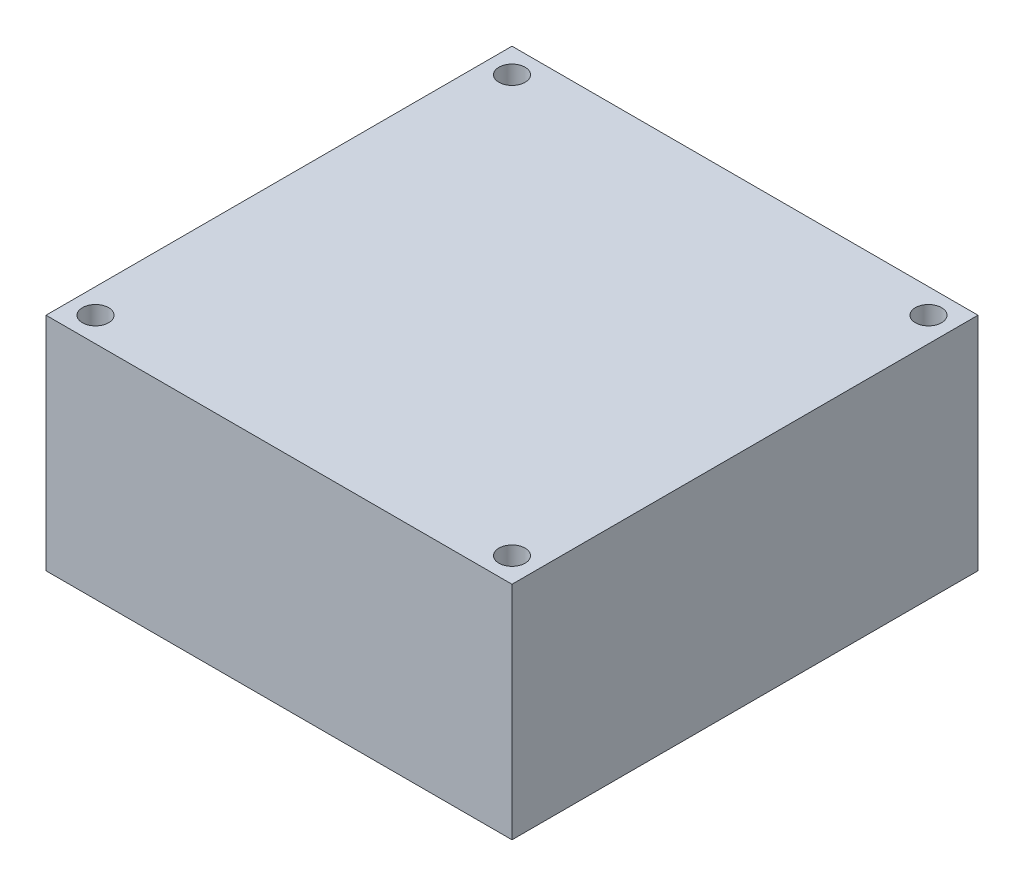
from build123d import *

# Parameters (mm, degrees)
SKETCH1_W           = 80
SKETCH1_H           = 80
BOSS_EXTRUDE1_DEPTH = 38
SKETCH2_R           = 2.25
CUT_EXTRUDE1_DEPTH  = 120.348229983


with BuildPart() as part:
    # Sketch1 → Boss-Extrude1 (new body)
    with BuildSketch(Plane(origin=(0, 0, 0), x_dir=(1, 0, 0), z_dir=(0, 1, 0))):
        with Locations((40, 40)):
            Rectangle(SKETCH1_W, SKETCH1_H)
    extrude(amount=BOSS_EXTRUDE1_DEPTH)

    # Sketch2 → Cut-Extrude1 (cut, through all)
    with BuildSketch(Plane(origin=(0, 38, 0), x_dir=(1, 0, 0), z_dir=(0, 1, 0))):
        with Locations(Location((4.25, 75.75, 0), (0, 0, 270))):
            Circle(SKETCH2_R)
        with Locations(Location((75.75, 75.75, 0), (0, 0, 270))):
            Circle(SKETCH2_R)
        with Locations(Location((75.75, 4.25, 0), (0, 0, 270))):
            Circle(SKETCH2_R)
        with Locations(Location((4.25, 4.25, 0), (0, 0, 270))):
            Circle(SKETCH2_R)
    extrude(amount=-CUT_EXTRUDE1_DEPTH, mode=Mode.SUBTRACT)


solid = part.part
